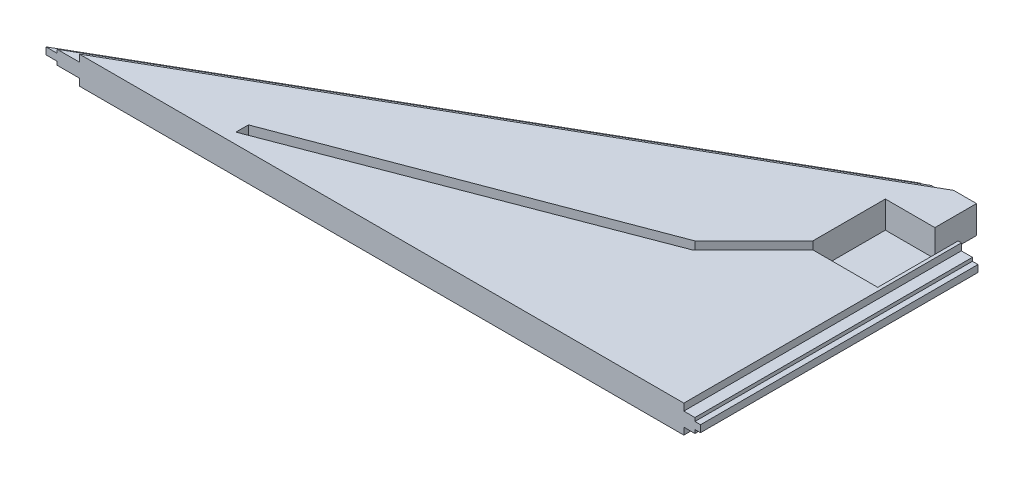
from build123d import *

# Parameters (mm, degrees)
BOSS_EXTRUDE1_DEPTH      = 6.35
BOSS_EXTRUDE1_DEPTH_BACK = 6.35
SKETCH2_W                = 292.995908675
SKETCH2_H                = 3.175
CUT_EXTRUDE1_DEPTH       = 38.1
SKETCH3_W                = 146.05
SKETCH3_H                = 3.175
CUT_EXTRUDE2_DEPTH       = 38.1
CUT_EXTRUDE3_DEPTH       = 3.175
CUT_EXTRUDE4_DEPTH       = 3.175
SKETCH6_W                = 5.08
SKETCH6_H                = 3.175
CUT_EXTRUDE5_DEPTH       = 157.099
CUT_EXTRUDE6_DEPTH       = 339.217
CUT_EXTRUDE6_DEPTH_BACK  = 157.099
SKETCH9_W                = 50.8
SKETCH9_H                = 19.05
CUT_EXTRUDE7_DEPTH       = 21.59
SKETCH10_W               = 33.269999954
SKETCH10_H               = 36.77000012
CUT_EXTRUDE9_DEPTH       = 12.35
SKETCH11_W               = 4.495000048
SKETCH11_H               = 19.05
CUT_EXTRUDE10_DEPTH      = 366.729881683
CUT_EXTRUDE11_DEPTH      = 5.08
SKETCH13_W               = 10.000000066
SKETCH13_H               = 4.999999906
CUT_EXTRUDE13_DEPTH      = 3.5


with BuildPart() as part:
    # Sketch1 → Boss-Extrude1 (new, two sides: drawn at the far end of the back side and taken through both)
    with BuildSketch(Plane(origin=(0, 0, 0), x_dir=(1, 0, 0), z_dir=(0, 1, 0)).offset(-BOSS_EXTRUDE1_DEPTH_BACK)):
        Polygon((-406.4, 0), (0, 0), (0, 146.05), (-152.4, 146.05), align=None)
    extrude(amount=BOSS_EXTRUDE1_DEPTH + BOSS_EXTRUDE1_DEPTH_BACK)

    # Sketch2 → Cut-Extrude1 (cut)
    with BuildSketch(Plane(origin=(-100.979614843, 0, -175.616721465), x_dir=(-0.8669063030575352, 0, 0.49847112425808277), z_dir=(-0.4984711242580827, 0, -0.8669063030575351))):
        with Locations((205.812767226, 4.7625)):
            Rectangle(SKETCH2_W, SKETCH2_H)
        with Locations((205.812767226, -4.7625)):
            Rectangle(SKETCH2_W, SKETCH2_H)
    extrude(amount=-CUT_EXTRUDE1_DEPTH, mode=Mode.SUBTRACT)

    # Sketch3 → Cut-Extrude2 (cut)
    with BuildSketch(Plane(origin=(0, 0, 0), x_dir=(0, 0, -1), z_dir=(1, 0, 0))):
        with Locations((73.025, 4.7625)):
            Rectangle(SKETCH3_W, SKETCH3_H)
        with Locations((73.025, -4.7625)):
            Rectangle(SKETCH3_W, SKETCH3_H)
    extrude(amount=-CUT_EXTRUDE2_DEPTH, mode=Mode.SUBTRACT)

    # Sketch4 → Cut-Extrude3 (cut)
    with BuildSketch(Plane(origin=(0, 6.35, 0), x_dir=(1, 0, 0), z_dir=(0, 1, 0))):
        Polygon((-133.408250166, 113.020869854), (-75.966284694, 146.05), (-152.4, 146.05), align=None)
    extrude(amount=-CUT_EXTRUDE3_DEPTH, mode=Mode.SUBTRACT)

    # Sketch5 → Cut-Extrude4 (cut)
    with BuildSketch(Plane.XZ.offset(6.35)):
        Polygon((-133.408250166, -113.020869854), (-75.966284694, -146.05), (-152.4, -146.05), align=None)
    extrude(amount=-CUT_EXTRUDE4_DEPTH, mode=Mode.SUBTRACT)

    # Sketch6 → Cut-Extrude5 (cut)
    with BuildSketch(Plane(origin=(0, 0, -146.05), x_dir=(-1, 0, 0), z_dir=(0, 0, -1))):
        Polygon((0, -3.175), (38.1, -3.175), (38.1, -1.5875), (35.56, -1.5875), (35.56, 1.5875), (38.1, 1.5875), (38.1, 3.175), (0, 3.175), align=None)
        with Locations((40.64, -4.7625)):
            Rectangle(SKETCH6_W, SKETCH6_H)
        with Locations((40.64, 4.7625)):
            Rectangle(SKETCH6_W, SKETCH6_H)
    extrude(amount=-CUT_EXTRUDE5_DEPTH, mode=Mode.SUBTRACT)

    # Sketch8 → Cut-Extrude6 (cut, two sides: drawn at the far end of the back side and taken through both)
    with BuildSketch(Plane(origin=(-51.420385157, 0, 29.566721465), x_dir=(0.49847112425808243, 0, 0.8669063030575355), z_dir=(-0.8669063030575355, 0, 0.49847112425808243)).offset(-CUT_EXTRUDE6_DEPTH_BACK)):
        Polygon((-164.478664898, 1.5875), (-164.478664898, 3.175), (-159.398664898, 3.175), (-159.398664898, 6.35), (-164.478664898, 6.35), (-202.578664898, 6.35), (-202.578664898, -6.35), (-164.478664898, -6.35), (-159.398664898, -6.35), (-159.398664898, -3.175), (-164.478664898, -3.175), (-164.478664898, -1.5875), (-167.018664898, -1.5875), (-167.018664898, 1.5875), align=None)
    extrude(amount=CUT_EXTRUDE6_DEPTH + CUT_EXTRUDE6_DEPTH_BACK, mode=Mode.SUBTRACT)

    # Sketch9 → Cut-Extrude7 (cut)
    with BuildSketch(Plane(origin=(0, 6.35, 0), x_dir=(1, 0, 0), z_dir=(0, 1, 0))):
        with Locations((-25.4, 136.525)):
            Rectangle(SKETCH9_W, SKETCH9_H)
    extrude(amount=-CUT_EXTRUDE7_DEPTH, mode=Mode.SUBTRACT)

    # Sketch10 → Cut-Extrude9 (cut)
    with BuildSketch(Plane(origin=(0, 6.35, 0), x_dir=(1, 0, 0), z_dir=(0, 1, 0))):
        with Locations((-61.315000025, 108.61499994)):
            Rectangle(SKETCH10_W, SKETCH10_H)
    extrude(amount=-CUT_EXTRUDE9_DEPTH, mode=Mode.SUBTRACT)

    # Sketch11 → Cut-Extrude10 (cut, through all)
    with BuildSketch(Plane(origin=(0, 6.35, 0), x_dir=(1, 0, 0), z_dir=(0, 1, 0))):
        with Locations((-53.047500024, 136.525)):
            Rectangle(SKETCH11_W, SKETCH11_H)
    extrude(amount=-CUT_EXTRUDE10_DEPTH, mode=Mode.SUBTRACT)

    # Sketch12 → Cut-Extrude11 (cut)
    with BuildSketch(Plane(origin=(0, 6.35, 0), x_dir=(1, 0, 0), z_dir=(0, 1, 0))):
        Polygon((-74.357897554, 90.22999988), (-77.950000002, 90.22999988), (-77.950000002, 93.822102328), (-104.958896043, 66.813206287), (-253.068107346, 10.634854577), (-253.068107346, 4.900877803), (-101.937140583, 62.65075685), align=None)
    extrude(amount=-CUT_EXTRUDE11_DEPTH, mode=Mode.SUBTRACT)

    # Sketch13 → Cut-Extrude13 (cut)
    with BuildSketch(Plane.ZY.offset(44.680000048)):
        with Locations((-104.106, 0.175)):
            Rectangle(SKETCH13_W, SKETCH13_H)
    extrude(amount=-CUT_EXTRUDE13_DEPTH, mode=Mode.SUBTRACT)


solid = part.part
